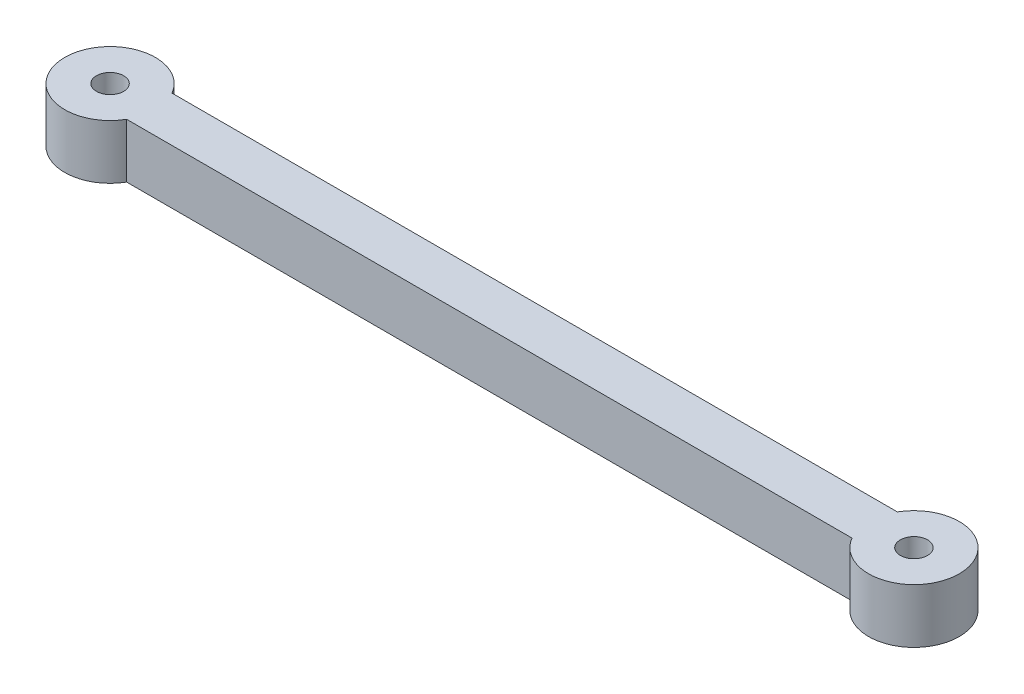
from build123d import *

# Parameters (mm, degrees)
BOSS_EXTRUDE1_DEPTH = 6
SKETCH2_R           = 1.5
CUT_EXTRUDE1_DEPTH  = 50.944583607


with BuildPart() as part:
    # Sketch1 → Boss-Extrude1 (new body)
    with BuildSketch(Plane(origin=(0, 0, 0), x_dir=(1, 0, 0), z_dir=(0, 1, 0))):
        with BuildLine():
            Line((-40, 2.5), (40, 2.5))
            ThreePointArc((40, 2.5), (49.330127019, 0), (40, -2.5))
            Line((40, -2.5), (-40, -2.5))
            ThreePointArc((-40, -2.5), (-49.330127019, 0), (-40, 2.5))
        make_face()
    extrude(amount=BOSS_EXTRUDE1_DEPTH)

    # Sketch2 → Cut-Extrude1 (cut, through all)
    with BuildSketch(Plane(origin=(0, 6, 0), x_dir=(1, 0, 0), z_dir=(0, 1, 0))):
        with Locations(Location((-44.330127019, 0, 0), (0, 0, 270))):
            Circle(SKETCH2_R)
        with Locations(Location((44.330127019, 0, 0), (0, 0, 270))):
            Circle(SKETCH2_R)
    extrude(amount=-CUT_EXTRUDE1_DEPTH, mode=Mode.SUBTRACT)


solid = part.part
